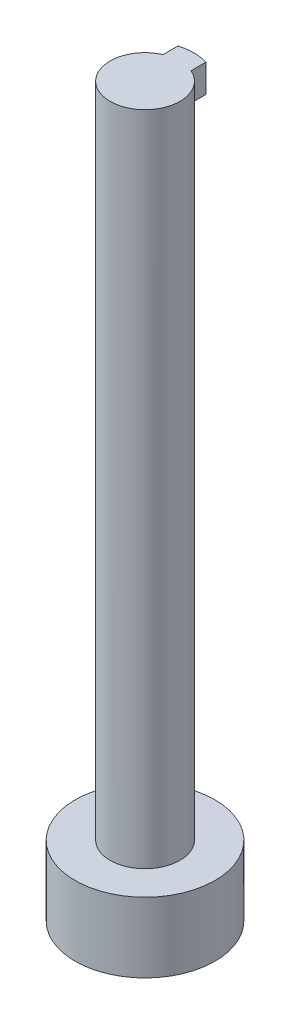
from build123d import *

# Parameters (mm, degrees)
SKETCH1_R           = 3.175
BOSS_EXTRUDE1_DEPTH = 66.04
BOSS_EXTRUDE2_START = -2.54
BOSS_EXTRUDE2_DEPTH = 2.54
SKETCH3_R           = 6.35
SKETCH3_R_2         = 3.175
BOSS_EXTRUDE3_DEPTH = 6.35


with BuildPart() as part:
    # Sketch1 → Boss-Extrude1 (new body)
    with BuildSketch(Plane(origin=(0, 0, 0), x_dir=(1, 0, 0), z_dir=(0, 1, 0))):
        with Locations(Location((0, 0, 0), (0, 0, 270))):
            Circle(SKETCH1_R)
    extrude(amount=BOSS_EXTRUDE1_DEPTH)

    # Sketch2 → Boss-Extrude2 (add)
    with BuildSketch(Plane(origin=(0, 66.04, 0), x_dir=(1, 0, 0), z_dir=(0, 1, 0)).offset(BOSS_EXTRUDE2_START)):
        with BuildLine():
            Line((1.27, 4.259709497), (1.27, 2.909935566))
            ThreePointArc((1.27, 2.909935566), (0, 3.175), (-1.27, 2.909935566))
            Line((-1.27, 2.909935566), (-1.27, 4.259709497))
            ThreePointArc((-1.27, 4.259709497), (0, 4.445), (1.27, 4.259709497))
        make_face()
    extrude(amount=BOSS_EXTRUDE2_DEPTH)

    # Sketch3 → Boss-Extrude3 (add)
    with BuildSketch(Plane.XZ):
        with Locations(Location((0, 0, 0), (0, 0, 270))):
            Circle(SKETCH3_R)
        with Locations(Location((0, 0, 0), (0, 0, 270))):
            Circle(SKETCH3_R_2, mode=Mode.SUBTRACT)
    extrude(amount=-BOSS_EXTRUDE3_DEPTH)


solid = part.part
